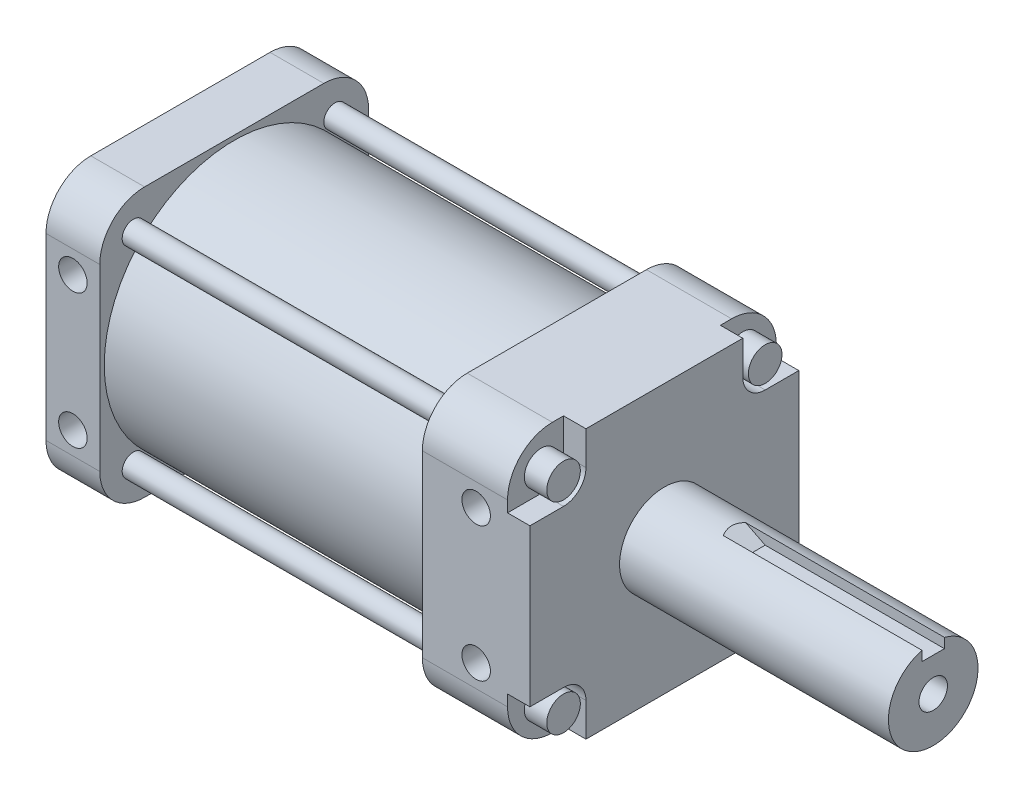
from build123d import *

# Parameters (mm, degrees)
BOSS_EXTRUDE1_DEPTH                  = 7.62
SKETCH2_R                            = 18.415
BOSS_EXTRUDE2_DEPTH                  = 45.72
BOSS_EXTRUDE3_DEPTH                  = 15.24
SKETCH5_R                            = 6.35
BOSS_EXTRUDE4_DEPTH                  = 38.1
F_10_32_TAPPED_HOLE1_D               = 4.0386
F_10_32_TAPPED_HOLE1_DEPTH           = 7.62
F_10_32_TAPPED_HOLE1_TIP             = 1.213317848
F_10_32_TAPPED_HOLE1_ON_FACE_2_D     = 4.0386
F_10_32_TAPPED_HOLE1_ON_FACE_2_DEPTH = 7.62
F_10_32_TAPPED_HOLE1_ON_FACE_2_TIP   = 1.213317848
CUT_EXTRUDE1_START                   = -7.62
SKETCH8_R                            = 17.78
CUT_EXTRUDE1_DEPTH                   = 45.72
CUT_EXTRUDE2_REACH                   = 112.029
SKETCH9_R                            = 6
CUT_EXTRUDE3_DEPTH                   = 1.5875
F_10_32_TAPPED_HOLE2_D               = 4.0386
F_10_32_TAPPED_HOLE2_DEPTH           = 7.62
F_10_32_TAPPED_HOLE2_TIP             = 1.213317848
CUT_EXTRUDE4_DEPTH                   = 3.175
BOSS_EXTRUDE5_REACH                  = 61.758
SKETCH15_R                           = 1.5875
SKETCH16_R                           = 2.38125
BOSS_EXTRUDE6_DEPTH                  = 3.175


with BuildPart() as part:
    # Sketch1 → Boss-Extrude1 (new body)
    with BuildSketch(Plane(origin=(0, 0, 0), x_dir=(0, 0, -1), z_dir=(1, 0, 0))):
        with BuildLine():
            Line((-12.7, 19.05), (12.7, 19.05))
            ThreePointArc((12.7, 19.05), (17.190128061, 17.190128061), (19.05, 12.7))
            Line((19.05, 12.7), (19.05, -12.7))
            ThreePointArc((19.05, -12.7), (17.190128061, -17.190128061), (12.7, -19.05))
            Line((12.7, -19.05), (-12.7, -19.05))
            ThreePointArc((-12.7, -19.05), (-17.190128061, -17.190128061), (-19.05, -12.7))
            Line((-19.05, -12.7), (-19.05, 12.7))
            ThreePointArc((-19.05, 12.7), (-17.190128061, 17.190128061), (-12.7, 19.05))
        make_face()
    extrude(amount=BOSS_EXTRUDE1_DEPTH)

    # Sketch2 → Boss-Extrude2 (add)
    with BuildSketch(Plane(origin=(7.62, 0, 0), x_dir=(0, 0, -1), z_dir=(1, 0, 0))):
        with Locations(Location((0, 0, 0), (0, 0, 180))):
            Circle(SKETCH2_R)
    extrude(amount=BOSS_EXTRUDE2_DEPTH)

    # Sketch4 → Boss-Extrude3 (add)
    with BuildSketch(Plane(origin=(53.34, 0, 0), x_dir=(0, 0, -1), z_dir=(1, 0, 0))):
        with BuildLine():
            Line((12.7, 19.05), (-12.7, 19.05))
            ThreePointArc((-12.7, 19.05), (-17.190128061, 17.190128061), (-19.05, 12.7))
            Line((-19.05, 12.7), (-19.05, -12.7))
            ThreePointArc((-19.05, -12.7), (-17.190128061, -17.190128061), (-12.7, -19.05))
            Line((-12.7, -19.05), (12.7, -19.05))
            ThreePointArc((12.7, -19.05), (17.190128061, -17.190128061), (19.05, -12.7))
            Line((19.05, -12.7), (19.05, 12.7))
            ThreePointArc((19.05, 12.7), (17.190128061, 17.190128061), (12.7, 19.05))
        make_face()
    extrude(amount=BOSS_EXTRUDE3_DEPTH)

    # Sketch5 → Boss-Extrude4 (add)
    with BuildSketch(Plane(origin=(68.58, 0, 0), x_dir=(0, 0, -1), z_dir=(1, 0, 0))):
        with Locations(Location((0, 0, 0), (0, 0, 180))):
            Circle(SKETCH5_R)
    extrude(amount=BOSS_EXTRUDE4_DEPTH)

    # #10-32 Tapped Hole1
    with Locations(Plane(origin=(60.96, 9.525, -19.05), x_dir=(-1, 0, 0), z_dir=(0, 0, -1))):
        with Locations((0, 0), (0, -19.05), (57.15, 0), (57.15, -19.05)):
            Hole(F_10_32_TAPPED_HOLE1_D / 2, depth=F_10_32_TAPPED_HOLE1_DEPTH)
            with Locations((0, 0, -(F_10_32_TAPPED_HOLE1_DEPTH + F_10_32_TAPPED_HOLE1_TIP / 2))):  # 118° drill point
                Cone(0, F_10_32_TAPPED_HOLE1_D / 2, F_10_32_TAPPED_HOLE1_TIP, mode=Mode.SUBTRACT)

    # #10-32 Tapped Hole1 on face 2
    with Locations(Plane(origin=(60.96, 9.525, 19.05), x_dir=(1, 0, 0), z_dir=(0, 0, 1))):
        with Locations((0, 0), (0, -19.05), (-57.15, 0), (-57.15, -19.05)):
            Hole(F_10_32_TAPPED_HOLE1_ON_FACE_2_D / 2, depth=F_10_32_TAPPED_HOLE1_ON_FACE_2_DEPTH)
            with Locations((0, 0, -(F_10_32_TAPPED_HOLE1_ON_FACE_2_DEPTH + F_10_32_TAPPED_HOLE1_ON_FACE_2_TIP / 2))):  # 118° drill point
                Cone(0, F_10_32_TAPPED_HOLE1_ON_FACE_2_D / 2, F_10_32_TAPPED_HOLE1_ON_FACE_2_TIP, mode=Mode.SUBTRACT)

    # Sketch8 → Cut-Extrude1 (cut)
    with BuildSketch(Plane.ZY.offset(CUT_EXTRUDE1_START)):
        Circle(SKETCH8_R)
    extrude(amount=-CUT_EXTRUDE1_DEPTH, mode=Mode.SUBTRACT)

    # Sketch9 → Cut-Extrude2 (cut, up to next)
    with BuildSketch(Plane.ZY, mode=Mode.PRIVATE) as cut_extrude2_sk1:
        Circle(SKETCH9_R)
    cut_extrude2_tool1 = extrude(cut_extrude2_sk1.sketch, amount=-CUT_EXTRUDE2_REACH, mode=Mode.PRIVATE) & part.part
    add(cut_extrude2_tool1.solids().sort_by_distance((0, 0, 0))[0], mode=Mode.SUBTRACT)

    # Sketch10 → Cut-Extrude3 (cut, symmetric)
    with BuildSketch(Plane.XY):
        Polygon((106.68, 4.7625), (81.28, 4.7625), (78.105, 6.35), (106.68, 6.35), align=None)
    extrude(amount=CUT_EXTRUDE3_DEPTH, both=True, mode=Mode.SUBTRACT)

    # #10-32 Tapped Hole2
    with Locations(Plane(origin=(106.68, 0, 0), x_dir=(0, 0, -1), z_dir=(1, 0, 0))):
        with Locations((0, 0)):
            Hole(F_10_32_TAPPED_HOLE2_D / 2, depth=F_10_32_TAPPED_HOLE2_DEPTH)
            with Locations((0, 0, -(F_10_32_TAPPED_HOLE2_DEPTH + F_10_32_TAPPED_HOLE2_TIP / 2))):  # 118° drill point
                Cone(0, F_10_32_TAPPED_HOLE2_D / 2, F_10_32_TAPPED_HOLE2_TIP, mode=Mode.SUBTRACT)

    # Sketch14 → Cut-Extrude4 (cut)
    with BuildSketch(Plane(origin=(68.58, 0, 0), x_dir=(0, 0, -1), z_dir=(1, 0, 0))):
        with BuildLine():
            Line((-14.2875, 11.1125), (-19.05, 11.1125))
            Line((-19.05, 11.1125), (-19.05, 19.05))
            Line((-19.05, 19.05), (-11.1125, 19.05))
            Line((-11.1125, 19.05), (-11.1125, 14.2875))
            ThreePointArc((-11.1125, 14.2875), (-12.04243597, 12.04243597), (-14.2875, 11.1125))
        make_face()
        with BuildLine():
            Line((-14.2875, -11.1125), (-19.05, -11.1125))
            Line((-19.05, -11.1125), (-19.05, -19.05))
            Line((-19.05, -19.05), (-11.1125, -19.05))
            Line((-11.1125, -19.05), (-11.1125, -14.2875))
            ThreePointArc((-11.1125, -14.2875), (-12.04243597, -12.04243597), (-14.2875, -11.1125))
        make_face()
        with BuildLine():
            Line((11.1125, 14.2875), (11.1125, 19.05))
            Line((11.1125, 19.05), (19.05, 19.05))
            Line((19.05, 19.05), (19.05, 11.1125))
            Line((19.05, 11.1125), (14.2875, 11.1125))
            ThreePointArc((14.2875, 11.1125), (12.04243597, 12.04243597), (11.1125, 14.2875))
        make_face()
        with BuildLine():
            Line((14.2875, -11.1125), (19.05, -11.1125))
            Line((19.05, -11.1125), (19.05, -19.05))
            Line((19.05, -19.05), (11.1125, -19.05))
            Line((11.1125, -19.05), (11.1125, -14.2875))
            ThreePointArc((11.1125, -14.2875), (12.04243597, -12.04243597), (14.2875, -11.1125))
        make_face()
    extrude(amount=-CUT_EXTRUDE4_DEPTH, mode=Mode.SUBTRACT)

    # Sketch15 → Boss-Extrude5 (add, up to next)
    with BuildSketch(Plane.ZY.offset(-53.34), mode=Mode.PRIVATE) as boss_extrude5_sk1:
        with Locations(Location((14.2875, 14.2875, 0), (0, 0, 180))):
            Circle(SKETCH15_R)
    boss_extrude5_tool1 = extrude(boss_extrude5_sk1.sketch, amount=BOSS_EXTRUDE5_REACH, mode=Mode.PRIVATE) - part.part
    # Sketch15 → Boss-Extrude5 (add, up to next)
    with BuildSketch(Plane.ZY.offset(-53.34), mode=Mode.PRIVATE) as boss_extrude5_sk2:
        with Locations(Location((-14.2875, 14.2875, 0), (0, 0, 180))):
            Circle(SKETCH15_R)
    boss_extrude5_tool2 = extrude(boss_extrude5_sk2.sketch, amount=BOSS_EXTRUDE5_REACH, mode=Mode.PRIVATE) - part.part
    # Sketch15 → Boss-Extrude5 (add, up to next)
    with BuildSketch(Plane.ZY.offset(-53.34), mode=Mode.PRIVATE) as boss_extrude5_sk3:
        with Locations(Location((14.2875, -14.2875, 0), (0, 0, 180))):
            Circle(SKETCH15_R)
    boss_extrude5_tool3 = extrude(boss_extrude5_sk3.sketch, amount=BOSS_EXTRUDE5_REACH, mode=Mode.PRIVATE) - part.part
    # Sketch15 → Boss-Extrude5 (add, up to next)
    with BuildSketch(Plane.ZY.offset(-53.34), mode=Mode.PRIVATE) as boss_extrude5_sk4:
        with Locations(Location((-14.2875, -14.2875, 0), (0, 0, 180))):
            Circle(SKETCH15_R)
    boss_extrude5_tool4 = extrude(boss_extrude5_sk4.sketch, amount=BOSS_EXTRUDE5_REACH, mode=Mode.PRIVATE) - part.part
    add(boss_extrude5_tool1.solids().sort_by_distance((53.34, 14.2875, 14.2875))[0])
    add(boss_extrude5_tool2.solids().sort_by_distance((53.34, 14.2875, -14.2875))[0])
    add(boss_extrude5_tool3.solids().sort_by_distance((53.34, -14.2875, 14.2875))[0])
    add(boss_extrude5_tool4.solids().sort_by_distance((53.34, -14.2875, -14.2875))[0])

    # Sketch16 → Boss-Extrude6 (add)
    with BuildSketch(Plane(origin=(65.405, 0, 0), x_dir=(0, 0, -1), z_dir=(1, 0, 0))):
        with Locations((-14.2875, 14.2875)):
            Circle(SKETCH16_R)
        with Locations((-14.2875, -14.2875)):
            Circle(SKETCH16_R)
        with Locations((14.2875, -14.2875)):
            Circle(SKETCH16_R)
        with Locations((14.2875, 14.2875)):
            Circle(SKETCH16_R)
    extrude(amount=BOSS_EXTRUDE6_DEPTH)


solid = part.part
